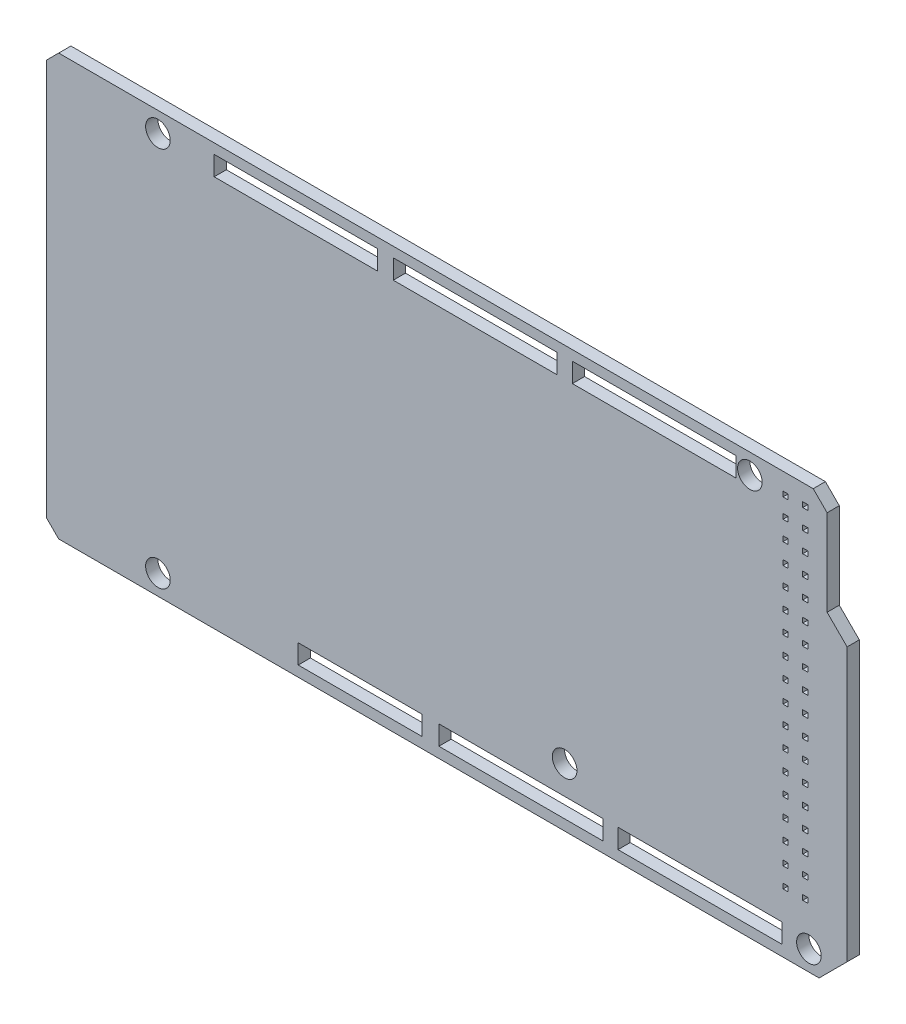
from build123d import *

# Parameters (mm, degrees)
CROQUIS1_R              = 1.5621
CROQUIS1_W              = 20.7518
CROQUIS1_H              = 2.4638
CROQUIS1_W_2            = 4.9784
CROQUIS1_H_2            = 46.2788
CROQUIS1_W_3            = 20.828
CROQUIS1_W_4            = 15.6972
CROQUIS1_H_3            = 2.449418676
SALIENTE_EXTRUIR1_DEPTH = 1.55
CROQUIS2_W              = 5
CROQUIS2_H              = 46.2788
CORTAR_EXTRUIR1_DEPTH   = 95.55
CROQUIS3_W              = 0.64
CROQUIS3_H              = 0.64
SALIENTE_EXTRUIR2_DEPTH = 1.55
CROQUIS3_3_W            = 0.64
CROQUIS3_3_H            = 0.64
CROQUIS3_3_H_2          = 0.640713362
SALIENTE_EXTRUIR3_DEPTH = 1.55


with BuildPart() as part:
    # Croquis1 → Saliente-Extruir1 (new body)
    with BuildSketch(Plane.XY):
        Polygon((46.546610497, 27.60316171), (48.310045797, 25.83972641), (48.310045797, 14.90316171), (50.850045797, 12.36316171), (50.850045797, -22.25703829), (47.294045797, -25.81303829), (-49.225954203, -25.81303829), (-50.749954203, -24.28903829), (-50.749954203, -22.00303829), (-50.749954203, -12.85903829), (-50.749954203, 6.39416171), (-50.749954203, 18.33216171), (-50.749954203, 26.07916171), (-49.225954203, 27.60316171), align=None)
        with Locations(Location((-36.627554203, -23.27303829, 0), (0, 0, 180))):
            Circle(CROQUIS1_R, mode=Mode.SUBTRACT)
        with Locations(Location((14.997945797, -18.394545523, 0), (0, 0, 180))):
            Circle(CROQUIS1_R, mode=Mode.SUBTRACT)
        with Locations(Location((45.998645797, -23.27303829, 0), (0, 0, 180))):
            Circle(CROQUIS1_R, mode=Mode.SUBTRACT)
        with Locations(Location((-36.627554203, 25.06316171, 0), (0, 0, 180))):
            Circle(CROQUIS1_R, mode=Mode.SUBTRACT)
        with Locations(Location((38.505645797, 25.06316171, 0), (0, 0, 180))):
            Circle(CROQUIS1_R, mode=Mode.SUBTRACT)
        with Locations((-19.114254203, 25.10126171)):
            Rectangle(CROQUIS1_W, CROQUIS1_H, mode=Mode.SUBTRACT)
        with Locations((3.618745797, 25.10126171)):
            Rectangle(CROQUIS1_W, CROQUIS1_H, mode=Mode.SUBTRACT)
        with Locations((26.351745797, 25.10126171)):
            Rectangle(CROQUIS1_W, CROQUIS1_H, mode=Mode.SUBTRACT)
        with Locations((44.296845797, 3.24456171)):
            Rectangle(CROQUIS1_W_2, CROQUIS1_H_2, mode=Mode.SUBTRACT)
        with Locations((32.181045797, -23.23493829)):
            Rectangle(CROQUIS1_W_3, CROQUIS1_H, mode=Mode.SUBTRACT)
        with Locations((9.448045797, -23.23493829)):
            Rectangle(CROQUIS1_W_3, CROQUIS1_H, mode=Mode.SUBTRACT)
        with Locations((-10.973554203, -23.242128952)):
            Rectangle(CROQUIS1_W_4, CROQUIS1_H_3, mode=Mode.SUBTRACT)
    extrude(amount=SALIENTE_EXTRUIR1_DEPTH)

    # Croquis2 → Cortar-Extruir1 (cut)
    with BuildSketch(Plane(origin=(0, 0, 0), x_dir=(-1, 0, 0), z_dir=(0, 0, -1))):
        with Locations((-44.286045797, 3.24456171)):
            Rectangle(CROQUIS2_W, CROQUIS2_H)
    extrude(amount=-CORTAR_EXTRUIR1_DEPTH, mode=Mode.SUBTRACT)

    # Croquis3 → Saliente-Extruir2 (add)
    with BuildSketch(Plane(origin=(0, 0, 0), x_dir=(-1, 0, 0), z_dir=(0, 0, -1))):
        Polygon((-45.85862689, -7.83483829), (-46.786045797, -7.83483829), (-46.786045797, -19.89483829), (-41.786045797, -19.89483829), (-41.786045797, -7.83483829), (-42.720004997, -7.83483829), (-42.720004997, -8.15483829), (-43.360004997, -8.15483829), (-43.360004997, -7.83483829), (-45.218685961, -7.83483829), (-45.218685961, -8.15483829), (-45.85862689, -8.15483829), align=None)
        with Locations((-45.538685961, -17.99483829)):
            Rectangle(CROQUIS3_W, CROQUIS3_H, mode=Mode.SUBTRACT)
        with Locations((-43.040004997, -17.99483829)):
            Rectangle(CROQUIS3_W, CROQUIS3_H, mode=Mode.SUBTRACT)
        with Locations((-45.538685961, -15.45483829)):
            Rectangle(CROQUIS3_W, CROQUIS3_H, mode=Mode.SUBTRACT)
        with Locations((-45.538685961, -12.91483829)):
            Rectangle(CROQUIS3_W, CROQUIS3_H, mode=Mode.SUBTRACT)
        with Locations((-43.040004997, -15.45483829)):
            Rectangle(CROQUIS3_W, CROQUIS3_H, mode=Mode.SUBTRACT)
        with Locations((-43.040004997, -12.91483829)):
            Rectangle(CROQUIS3_W, CROQUIS3_H, mode=Mode.SUBTRACT)
        with Locations((-45.538685961, -10.37483829)):
            Rectangle(CROQUIS3_W, CROQUIS3_H, mode=Mode.SUBTRACT)
        with Locations((-43.040004997, -10.37483829)):
            Rectangle(CROQUIS3_W, CROQUIS3_H, mode=Mode.SUBTRACT)
    extrude(amount=-SALIENTE_EXTRUIR2_DEPTH)

    # Croquis3<3> → Saliente-Extruir3 (add)
    with BuildSketch(Plane(origin=(0, 0, 0), x_dir=(-1, 0, 0), z_dir=(0, 0, -1))):
        Polygon((-46.786045797, 26.38396171), (-46.786045797, -7.83483829), (-45.85862689, -7.83483829), (-45.85862689, -7.51483829), (-45.218685961, -7.51483829), (-45.218685961, -7.83483829), (-43.360004997, -7.83483829), (-43.360004997, -7.51483829), (-42.720004997, -7.51483829), (-42.720004997, -7.83483829), (-41.786045797, -7.83483829), (-41.786045797, 26.38396171), align=None)
        with Locations((-45.538685961, -5.29483829)):
            Rectangle(CROQUIS3_3_W, CROQUIS3_3_H, mode=Mode.SUBTRACT)
        with Locations((-45.538685961, -2.75483829)):
            Rectangle(CROQUIS3_3_W, CROQUIS3_3_H, mode=Mode.SUBTRACT)
        with Locations((-43.040004997, -5.29483829)):
            Rectangle(CROQUIS3_3_W, CROQUIS3_3_H, mode=Mode.SUBTRACT)
        with Locations((-43.040004997, -2.75483829)):
            Rectangle(CROQUIS3_3_W, CROQUIS3_3_H, mode=Mode.SUBTRACT)
        with Locations((-45.538685961, -0.21483829)):
            Rectangle(CROQUIS3_3_W, CROQUIS3_3_H, mode=Mode.SUBTRACT)
        with Locations((-43.040004997, -0.21483829)):
            Rectangle(CROQUIS3_3_W, CROQUIS3_3_H, mode=Mode.SUBTRACT)
        with Locations((-45.538685961, 2.32516171)):
            Rectangle(CROQUIS3_3_W, CROQUIS3_3_H, mode=Mode.SUBTRACT)
        with Locations((-43.040004997, 2.32516171)):
            Rectangle(CROQUIS3_3_W, CROQUIS3_3_H, mode=Mode.SUBTRACT)
        with Locations((-45.538685961, 4.86516171)):
            Rectangle(CROQUIS3_3_W, CROQUIS3_3_H, mode=Mode.SUBTRACT)
        with Locations((-45.538685961, 7.40516171)):
            Rectangle(CROQUIS3_3_W, CROQUIS3_3_H, mode=Mode.SUBTRACT)
        with Locations((-43.040004997, 4.86516171)):
            Rectangle(CROQUIS3_3_W, CROQUIS3_3_H, mode=Mode.SUBTRACT)
        with Locations((-43.040004997, 7.40516171)):
            Rectangle(CROQUIS3_3_W, CROQUIS3_3_H, mode=Mode.SUBTRACT)
        with Locations((-45.538685961, 9.94516171)):
            Rectangle(CROQUIS3_3_W, CROQUIS3_3_H, mode=Mode.SUBTRACT)
        with Locations((-43.040004997, 9.94516171)):
            Rectangle(CROQUIS3_3_W, CROQUIS3_3_H, mode=Mode.SUBTRACT)
        with Locations((-45.538685961, 12.48516171)):
            Rectangle(CROQUIS3_3_W, CROQUIS3_3_H, mode=Mode.SUBTRACT)
        with Locations((-43.040004997, 12.48516171)):
            Rectangle(CROQUIS3_3_W, CROQUIS3_3_H, mode=Mode.SUBTRACT)
        with Locations((-45.538685961, 15.02516171)):
            Rectangle(CROQUIS3_3_W, CROQUIS3_3_H, mode=Mode.SUBTRACT)
        with Locations((-45.538685961, 17.56516171)):
            Rectangle(CROQUIS3_3_W, CROQUIS3_3_H, mode=Mode.SUBTRACT)
        with Locations((-43.040004997, 15.02516171)):
            Rectangle(CROQUIS3_3_W, CROQUIS3_3_H, mode=Mode.SUBTRACT)
        with Locations((-43.040004997, 17.56516171)):
            Rectangle(CROQUIS3_3_W, CROQUIS3_3_H, mode=Mode.SUBTRACT)
        with Locations((-45.538685961, 20.10516171)):
            Rectangle(CROQUIS3_3_W, CROQUIS3_3_H, mode=Mode.SUBTRACT)
        with Locations((-43.040004997, 20.18636171)):
            Rectangle(CROQUIS3_3_W, CROQUIS3_3_H_2, mode=Mode.SUBTRACT)
        with Locations((-45.538685961, 22.64516171)):
            Rectangle(CROQUIS3_3_W, CROQUIS3_3_H, mode=Mode.SUBTRACT)
        with Locations((-43.036045797, 22.64516171)):
            Rectangle(CROQUIS3_3_W, CROQUIS3_3_H, mode=Mode.SUBTRACT)
        with Locations((-45.538685961, 25.18516171)):
            Rectangle(CROQUIS3_3_W, CROQUIS3_3_H, mode=Mode.SUBTRACT)
        with Locations((-43.040004997, 25.10396171)):
            Rectangle(CROQUIS3_3_W, CROQUIS3_3_H_2, mode=Mode.SUBTRACT)
    extrude(amount=-SALIENTE_EXTRUIR3_DEPTH)


solid = part.part
